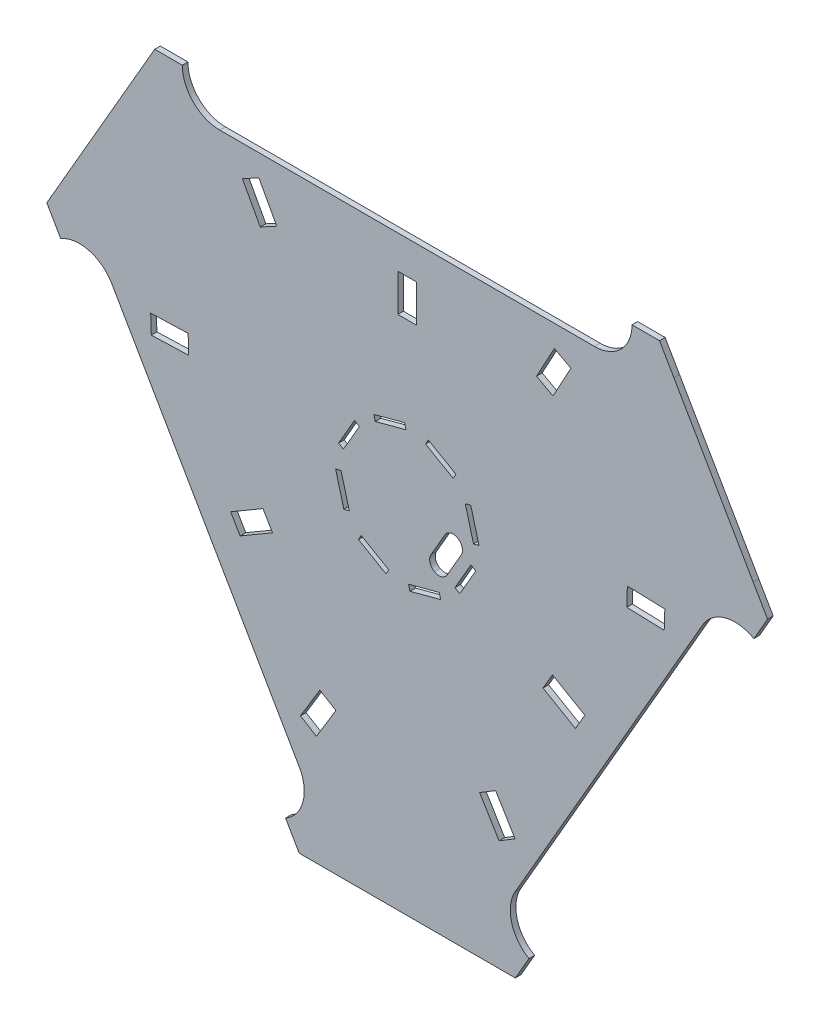
from build123d import *

# Parameters (mm, degrees)
MODEL_W                 = 10.000078668
MODEL_H                 = 19.99998508
BOSS_EXTRU_1_DEPTH      = 3
ENL_V_MAT_EXTRU_2_DEPTH = 1392.526576556


with BuildPart() as part:
    # Model → Boss.-Extru.1 (new body)
    with BuildSketch(Plane.XY):
        with BuildLine():
            Line((347.504229039, -990.984743501), (447.504154456, -1164.189847387))
            add(Edge.make_bspline(
                [(447.504154456, -1164.189847387), (453.026125757, -1173.754121475), (449.749150931, -1185.983779814), (440.184876843, -1191.505837242)],
                knots=[1, 1, 1, 1, 2, 2, 2, 2], degree=3))
            Line((440.184876843, -1191.505837242), (447.468153212, -1204.120743383))
            Line((447.468153212, -1204.120743383), (462.904937066, -1204.120743383))
            Line((462.904937066, -1204.120743383), (547.394870334, -1204.120743383))
            Line((547.394870334, -1204.120743383), (562.831654188, -1204.120743383))
            Line((562.831654188, -1204.120743383), (570.114930554, -1191.505837241))
            add(Edge.make_bspline(
                [(570.114930554, -1191.505837241), (560.550656465, -1185.983779815), (557.273681638, -1173.754121476), (562.795652937, -1164.189847387)],
                knots=[7, 7, 7, 7, 8, 8, 8, 8], degree=3))
            Line((562.795652937, -1164.189847387), (662.795578323, -990.984743483))
            add(Edge.make_bspline(
                [(662.795578323, -990.984743483), (668.317549622, -981.420469394), (680.547294088, -978.143580694), (690.111568177, -983.665465865)],
                knots=[9, 9, 9, 9, 10, 10, 10, 10], degree=3))
            Line((690.111568177, -983.665465865), (697.445659701, -970.962451406))
            Line((697.445659701, -970.962451406), (689.778082931, -957.6818667))
            Line((689.778082931, -957.6818667), (647.435103324, -884.341812722))
            Line((647.435103324, -884.341812722), (639.77820635, -871.079314757))
            Line((639.77820635, -871.079314757), (625.092281057, -871.079314757))
            add(Edge.make_bspline(
                [(625.092281057, -871.079314757), (625.092281058, -882.124979905), (616.137961126, -891.079299838), (605.092295979, -891.079299839)],
                knots=[17, 17, 17, 17, 18, 18, 18, 18], degree=3))
            Line((605.092295979, -891.079299839), (405.092272921, -891.079299839))
            add(Edge.make_bspline(
                [(405.092272921, -891.079299839), (394.046607773, -891.07929984), (385.09228784, -882.124979908), (385.092287839, -871.079314761)],
                knots=[19, 19, 19, 19, 20, 20, 20, 20], degree=3))
            Line((385.092287839, -871.079314761), (370.370533553, -871.079314761))
            Line((370.370533553, -871.079314761), (312.778700066, -970.831623929))
            Line((312.778700066, -970.831623929), (320.188239184, -983.665465888))
            add(Edge.make_bspline(
                [(320.188239184, -983.665465888), (329.752513272, -978.143494587), (341.982257738, -981.420469413), (347.504229039, -990.984743501)],
                knots=[23, 23, 23, 23, 24, 24, 24, 24], degree=3))
        make_face()
        Polygon((622.618702509, -993.05007822), (642.608524558, -993.687248628), (642.290025481, -1003.682159653), (622.300031178, -1003.044989244), align=None, mode=Mode.SUBTRACT)
        Polygon((594.878104643, -1072.794736968), (577.611630575, -1062.701812979), (582.658178697, -1054.068575945), (599.924652765, -1064.161499934), align=None, mode=Mode.SUBTRACT)
        Polygon((583.685161648, -902.731560157), (592.474806017, -907.50051971), (582.937059165, -925.079722321), (574.147414796, -920.310848895), align=None, mode=Mode.SUBTRACT)
        Polygon((552.326007751, -1122.752411126), (562.689371739, -1139.857999232), (554.136577686, -1145.039681226), (543.773213697, -1127.93409312), align=None, mode=Mode.SUBTRACT)
        with Locations((505.092198326, -918.785791257)):
            Rectangle(MODEL_W, MODEL_H, mode=Mode.SUBTRACT)
        Polygon((458.493147779, -1123.193383356), (467.045941833, -1128.375065349), (456.682577848, -1145.480653457), (448.129783794, -1140.298971465), align=None, mode=Mode.SUBTRACT)
        Polygon((425.950948052, -902.731560171), (435.488694907, -920.310848907), (426.699050539, -925.079722335), (417.161303684, -907.500519726), align=None, mode=Mode.SUBTRACT)
        Polygon((428.161149075, -1054.509548181), (433.207697199, -1063.142785214), (415.941223133, -1073.235709206), (410.894675009, -1064.602472173), align=None, mode=Mode.SUBTRACT)
        Polygon((388.200625252, -993.491050463), (388.519124331, -1003.485961487), (368.529302282, -1004.123131899), (368.210803204, -994.128220875), align=None, mode=Mode.SUBTRACT)
    extrude(amount=BOSS_EXTRU_1_DEPTH)

    # Esquisse2 → Enlèv. mat.-Extru.2 (cut, through all)
    with BuildSketch(Plane(origin=(0, 0, 0), x_dir=(-1, 0, 0), z_dir=(0, 0, -1))):
        with BuildLine():
            Line((-526.434334105, -1036.035042627), (-533.934329365, -1023.044658352))
            add(Edge.make_bspline(
                [(-533.934329365, -1023.044658352), (-535.315042909, -1020.653190239), (-534.495664502, -1017.595243477), (-532.104199693, -1016.21453184)],
                knots=[1, 1, 1, 1, 2, 2, 2, 2], degree=3))
            add(Edge.make_bspline(
                [(-532.104199693, -1016.21453184), (-529.712734884, -1014.833820204), (-526.654786726, -1015.653193399), (-525.274073182, -1018.044661512)],
                knots=[2, 2, 2, 2, 3, 3, 3, 3], degree=3))
            Line((-525.274073182, -1018.044661512), (-517.774077922, -1031.035045787))
            add(Edge.make_bspline(
                [(-517.774077922, -1031.035045787), (-516.393364378, -1033.4265139), (-517.212742785, -1036.484460663), (-519.604207594, -1037.865172299)],
                knots=[4, 4, 4, 4, 5, 5, 5, 5], degree=3))
            add(Edge.make_bspline(
                [(-519.604207594, -1037.865172299), (-521.995672403, -1039.245883936), (-525.053620562, -1038.42651074), (-526.434334105, -1036.035042627)],
                knots=[5, 5, 5, 5, 6, 6, 6, 6], degree=3))
        make_face()
        Polygon((-466.912163294, -1016.838076711), (-471.311987833, -1033.258962352), (-474.209588183, -1032.482769314), (-469.809499355, -1016.061731085), align=None)
        Polygon((-505.784176347, -1050.63498378), (-522.204989382, -1046.234888271), (-522.981588875, -1049.132379712), (-506.560775841, -1053.532475221), align=None)
        Polygon((-543.414554373, -1013.888013101), (-540.516954023, -1014.664206139), (-536.117129484, -998.243320497), (-539.014729835, -997.467127459), align=None)
        Polygon((-487.287063031, -981.399673764), (-503.708140356, -976.999730842), (-504.48424394, -979.898081226), (-488.064270392, -984.297516156), align=None)
        Polygon((-539.08988115, -1025.104375563), (-530.589886522, -1039.826811075), (-533.187963377, -1041.326810127), (-541.687958005, -1026.604374615), align=None)
        Polygon((-516.425728308, -978.663411899), (-514.925729256, -981.261488754), (-529.648164768, -989.761483382), (-531.14816382, -987.163406527), align=None)
        Polygon((-479.095212457, -1043.319423279), (-480.595215323, -1040.721339817), (-495.317650835, -1049.221334445), (-493.817647969, -1051.819417907), align=None)
        Polygon((-476.996433275, -989.335575737), (-468.496438647, -1004.058011249), (-471.094515502, -1005.558010301), (-479.59451013, -990.835574789), align=None)
    extrude(amount=-ENL_V_MAT_EXTRU_2_DEPTH, mode=Mode.SUBTRACT)


solid = part.part
